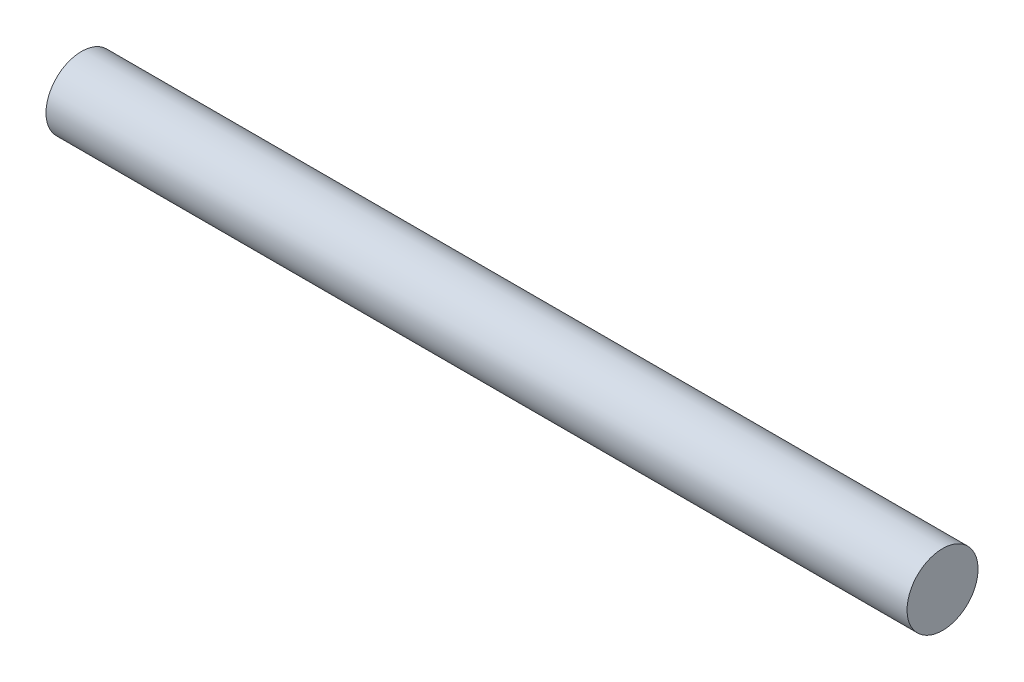
from build123d import *

# Parameters (mm, degrees)
SKETCH1_R           = 4
BOSS_EXTRUDE1_DEPTH = 48.5


with BuildPart() as part:
    # Sketch1 → Boss-Extrude1 (new, symmetric)
    with BuildSketch(Plane(origin=(0, 0, 0), x_dir=(0, 0, -1), z_dir=(1, 0, 0))):
        Circle(SKETCH1_R)
    extrude(amount=BOSS_EXTRUDE1_DEPTH, both=True)


solid = part.part
